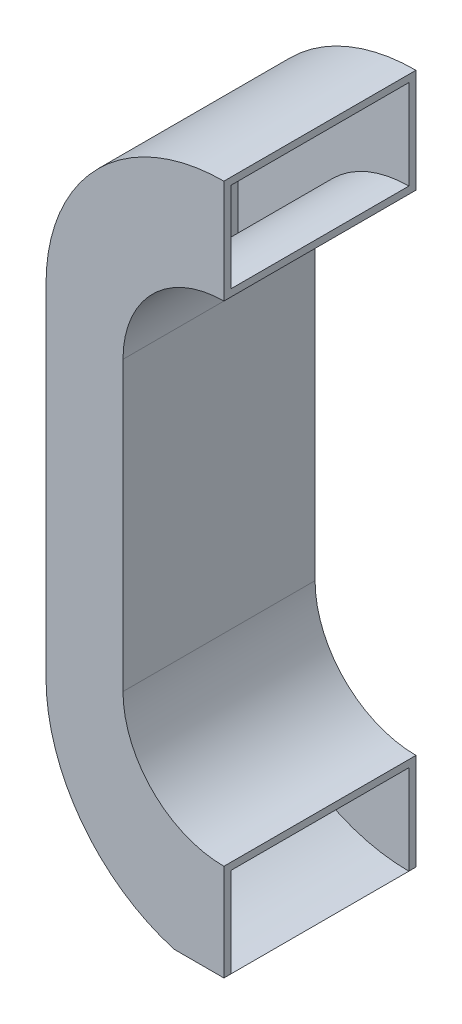
from build123d import *

# Parameters (mm, degrees)
BOSS_EXTRUDE1_DEPTH   = 79.375
BOSS_EXTRUDE1_2_DEPTH = 79.375
BOSS_EXTRUDE2_DEPTH   = 3.175
BOSS_EXTRUDE3_START   = 3.175
BOSS_EXTRUDE3_DEPTH   = 3.175


with BuildPart() as part:
    # Sketch2 → Boss-Extrude1 (new body)
    with BuildSketch(Plane.XY):
        with BuildLine():
            Line((0, 304.8), (0, 307.975))
            ThreePointArc((0, 307.975), (-56.126600757, 284.726600757), (-79.375, 228.6))
            Line((-79.375, 228.6), (-79.375, 76.2))
            ThreePointArc((-79.375, 76.2), (-63.5, 28.575), (-22.225, 0))
            Line((-22.225, 0), (0, 0))
            ThreePointArc((0, 0), (-53.881536726, 22.318463274), (-76.2, 76.2))
            Line((-76.2, 76.2), (-76.2, 228.6))
            ThreePointArc((-76.2, 228.6), (-53.881536726, 282.481536726), (0, 304.8))
        make_face()
    extrude(amount=BOSS_EXTRUDE1_DEPTH)



with BuildPart() as body_2:
    # Sketch2 → Boss-Extrude1 2 (new body)
    with BuildSketch(Plane.XY):
        with BuildLine():
            ThreePointArc((-48.2, 88.2), (-34.082546853, 54.117453147), (0, 40))
            Line((0, 40), (0, 43.175))
            ThreePointArc((0, 43.175), (-31.837482823, 56.362517177), (-45.025, 88.2))
            Line((-45.025, 88.2), (-45.025, 216.6))
            ThreePointArc((-45.025, 216.6), (-31.837482823, 248.437482823), (0, 261.625))
            Line((0, 261.625), (0, 264.8))
            ThreePointArc((0, 264.8), (-34.082546853, 250.682546853), (-48.2, 216.6))
            Line((-48.2, 216.6), (-48.2, 88.2))
        make_face()
    extrude(amount=BOSS_EXTRUDE1_2_DEPTH)


with BuildPart() as part_1:
    add(part.part)

    add(body_2.part)  # Boss-Extrude2 merges body 2
    # Sketch3 → Boss-Extrude2 (add)
    with BuildSketch(Plane.XY.offset(79.375)):
        with BuildLine():
            Line((-45.025, 88.2), (-45.025, 216.6))
            ThreePointArc((-45.025, 216.6), (-31.837482823, 248.437482823), (0, 261.625))
            Line((0, 261.625), (0, 307.975))
            ThreePointArc((0, 307.975), (-56.126600757, 284.726600757), (-79.375, 228.6))
            Line((-79.375, 228.6), (-79.375, 76.2))
            ThreePointArc((-79.375, 76.2), (-63.5, 28.575), (-22.225, 0))
            Line((-22.225, 0), (0, 0))
            Line((0, 0), (0, 43.175))
            ThreePointArc((0, 43.175), (-31.837482823, 56.362517177), (-45.025, 88.2))
        make_face()
    extrude(amount=BOSS_EXTRUDE2_DEPTH)

    # Sketch4 → Boss-Extrude3 (add)
    with BuildSketch(Plane(origin=(0, 0, 0), x_dir=(-1, 0, 0), z_dir=(0, 0, -1)).offset(BOSS_EXTRUDE3_START)):
        with BuildLine():
            Line((79.375, 76.2), (79.375, 228.6))
            ThreePointArc((79.375, 228.6), (56.126600757, 284.726600757), (0, 307.975))
            Line((0, 307.975), (0, 261.625))
            ThreePointArc((0, 261.625), (31.837482823, 248.437482823), (45.025, 216.6))
            Line((45.025, 216.6), (45.025, 88.2))
            ThreePointArc((45.025, 88.2), (31.837482823, 56.362517177), (0, 43.175))
            Line((0, 43.175), (0, 0))
            Line((0, 0), (22.225, 0))
            ThreePointArc((22.225, 0), (63.5, 28.575), (79.375, 76.2))
        make_face()
    extrude(amount=-BOSS_EXTRUDE3_DEPTH)


solid = part_1.part
